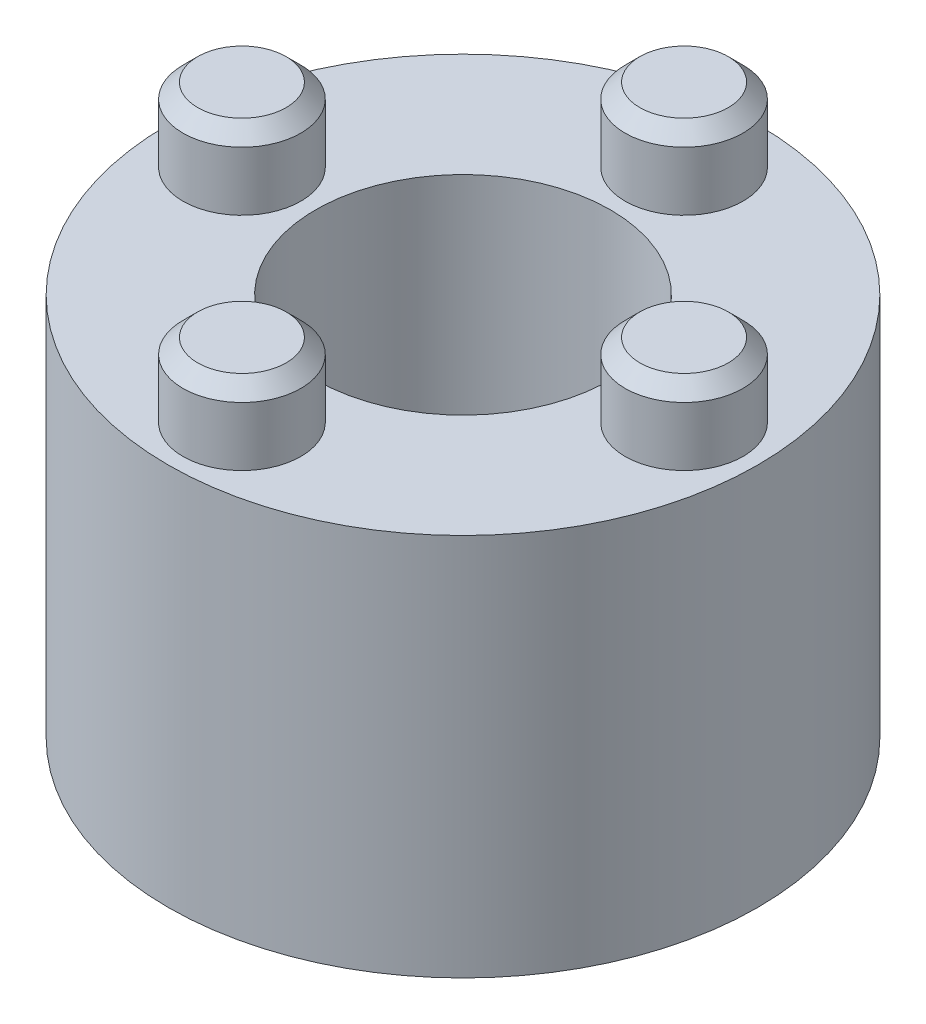
from build123d import *

# Parameters (mm, degrees)
SKETCH_1_R      = 10
SKETCH_1_R_2    = 5
EXTRUDE_1_DEPTH = 13
SKETCH_2_R      = 2
EXTRUDE_2_DEPTH = 2.5
CHAMFER_1_SIZE  = 0.5


with BuildPart() as part:
    # 草图1 → 凸台-拉伸1 (new body)
    with BuildSketch(Plane(origin=(0, 0, 0), x_dir=(1, 0, 0), z_dir=(0, 1, 0))):
        with Locations(Location((0, 0, 0), (0, 0, 90))):
            Circle(SKETCH_1_R)
        with Locations(Location((0, 0, 0), (0, 0, 90))):
            Circle(SKETCH_1_R_2, mode=Mode.SUBTRACT)
    extrude(amount=EXTRUDE_1_DEPTH)

    # 草图2 → 凸台-拉伸2 (add)
    with BuildSketch(Plane(origin=(0, 13, 0), x_dir=(1, 0, 0), z_dir=(0, 1, 0))):
        with Locations(Location((0, 7.5, 0), (0, 0, 270))):
            Circle(SKETCH_2_R)
        with Locations(Location((7.5, 0, 0), (0, 0, 270))):
            Circle(SKETCH_2_R)
        with Locations(Location((0, -7.5, 0), (0, 0, 270))):
            Circle(SKETCH_2_R)
        with Locations(Location((-7.5, 0, 0), (0, 0, 270))):
            Circle(SKETCH_2_R)
    extrude(amount=EXTRUDE_2_DEPTH)

    # 倒角1
    chamfer_1_edges = [part.edges().sort_by_distance(p)[0] for p in [
        (0, 15.5, -9.5),
        (7.5, 15.5, -2),
        (0, 15.5, 5.5),
        (-7.5, 15.5, -2),
    ]]
    chamfer(chamfer_1_edges, length=CHAMFER_1_SIZE)


solid = part.part
